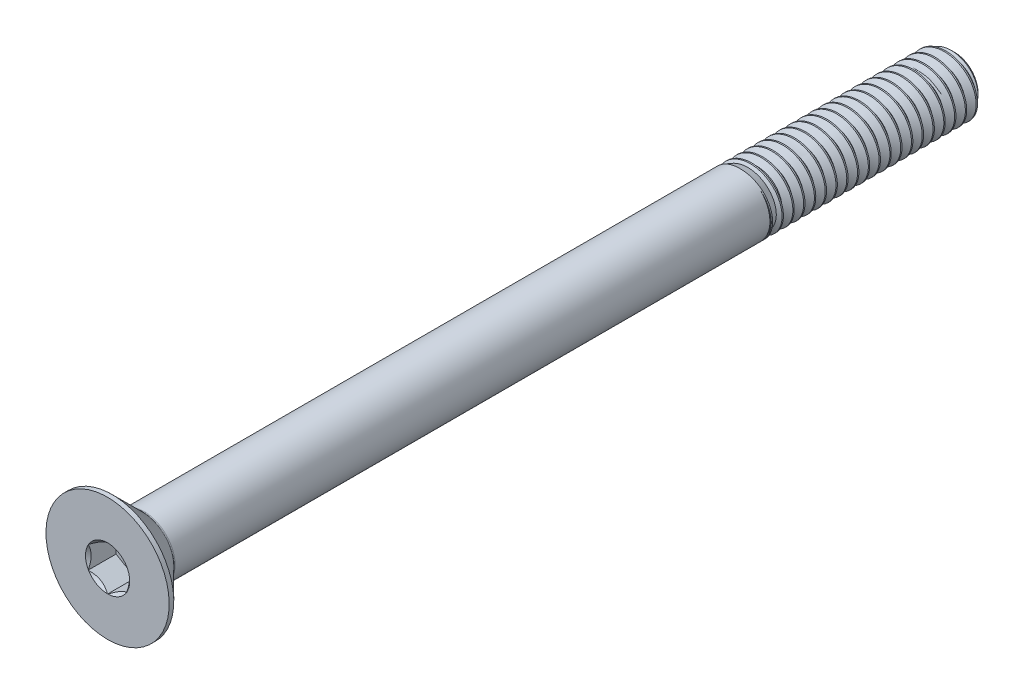
from build123d import *
from build123d.topology import SkipClean

# Parameters (mm, degrees)
CUT_EXTRUDE1_DEPTH            = 1.8
FILLET1_R                     = 0.2
CUT_SWEEP1_PITCH              = 0.7
CUT_SWEEP1_HEIGHT             = 14.7
CUT_SWEEP1_RADIUS             = 2
CUT_SWEEP1_START_ANGLE        = 90
SKETCH9_R                     = 2
BOSS_EXTRUDE1_DEPTH           = 1.4
BOSS_EXTRUDE1_OTHER_WAY_DEPTH = 2.1
BOSS_EXTRUDE1_OTHER_WAY_TAPER = 20


with BuildPart() as part:
    # Sketch4 → Revolve1 (revolve)
    with BuildSketch(Plane(origin=(0, 0, 0), x_dir=(0, 0, -1), z_dir=(1, 0, 0)), mode=Mode.PRIVATE) as revolve1_sk:
        Polygon((2.3, 2), (0.3, 4), (0, 4), (0, 0), (55, 0), (55, 1.51), (54.51, 2), align=None)
    revolve(revolve1_sk.sketch.rotate(Axis((0, 0, 0), (0, 0, -1)), 180), axis=Axis((0, 0, 0), (0, 0, -1)))

    # Sketch5 → Cut-Extrude1 (cut)
    with BuildSketch(Plane.XY):
        Polygon((-1.25, 0.721687836), (-1.25, -0.721687836), (0, -1.443375673), (1.25, -0.721687836), (1.25, 0.721687836), (0, 1.443375673), align=None)
    extrude(amount=-CUT_EXTRUDE1_DEPTH, mode=Mode.SUBTRACT)

    # Cut-Extrude2 cone 1 section (through the dimple's axis) → Cut-Extrude2 (revolve, cut)
    with BuildSketch(Plane(origin=(0, 0, 0), x_dir=(0, -1, 0), z_dir=(1, 0, 0))):
        Polygon((0, 0), (1.435, 0), (0, 1.435), align=None)
    revolve(axis=Axis((0, 0, 0), (0, 0, -1)), mode=Mode.SUBTRACT)

    # Fillet1
    fillet1_edges = [part.edges().sort_by_distance(p)[0] for p in [
        (0, 2, -2.3),
    ]]
    fillet(fillet1_edges, radius=FILLET1_R)

    # Cut-Sweep1: sweep along a helix
    with BuildLine() as cut_sweep1_path:
        add(Helix(CUT_SWEEP1_PITCH, CUT_SWEEP1_HEIGHT, CUT_SWEEP1_RADIUS, center=(0, 0, -55), direction=(0, 0, 1), mode=Mode.PRIVATE).rotate(Axis((0, 0, -55), (0, 0, 1)), CUT_SWEEP1_START_ANGLE))
    # Sketch7 → Cut-Sweep1 (sweep, cut)
    with BuildSketch(Plane(origin=(0, 0, 0), x_dir=(0, 0, -1), z_dir=(1, 0, 0))):
        Polygon((54.978125, 2.037888611), (55.634375, 2.037888611), (55.35, 1.545336663), (55.2625, 1.545336663), align=None)
    sweep(path=cut_sweep1_path.line, is_frenet=True, mode=Mode.SUBTRACT)

    # Sketch9 → Boss-Extrude1 (add)
    with SkipClean():  # the faces are left unmerged after this step: merging them gives an invalid solid
        with BuildSketch(Plane.XY.offset(-41)):
            with Locations(Location((0, 0, 0), (0, 0, 270))):
                Circle(SKETCH9_R)
        extrude(amount=BOSS_EXTRUDE1_DEPTH)

    # Sketch9 → Boss-Extrude1 other way (add)
    with SkipClean():  # the faces are left unmerged after this step: merging them gives an invalid solid
        with BuildSketch(Plane.XY.offset(-41)):
            with Locations(Location((0, 0, 0), (0, 0, 270))):
                Circle(SKETCH9_R)
        extrude(amount=-BOSS_EXTRUDE1_OTHER_WAY_DEPTH, taper=BOSS_EXTRUDE1_OTHER_WAY_TAPER)


solid = part.part
